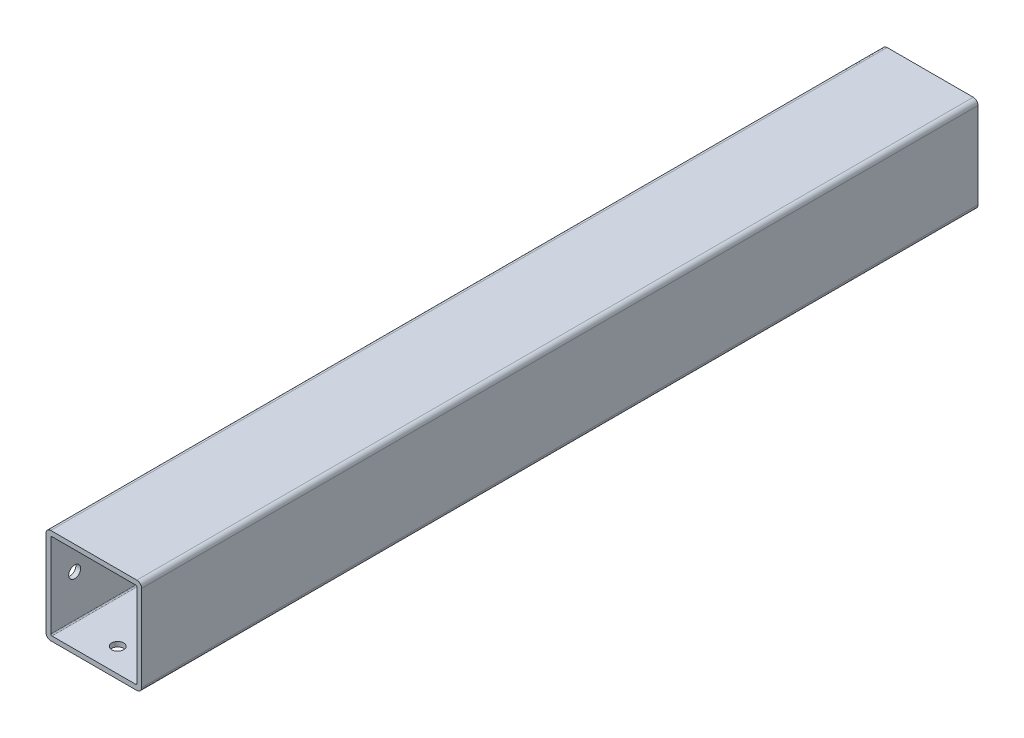
from build123d import *

# Parameters (mm, degrees)
SKETCH1_W           = 40
SKETCH1_H           = 40
SKETCH1_W_2         = 36
SKETCH1_H_2         = 36
EXTRUDE_THIN1_DEPTH = 350
FILLET1_R           = 0.5
FILLET2_R           = 2
SKETCH2_R           = 2.5
CUT_EXTRUDE1_DEPTH  = 352.140997322
CIRPATTERN1_COUNT   = 2
CIRPATTERN1_ANGLE   = 90


with BuildPart() as part:
    # Sketch1 → Extrude-Thin1 (new body)
    with BuildSketch(Plane.XY):
        Rectangle(SKETCH1_W, SKETCH1_H)
        Rectangle(SKETCH1_W_2, SKETCH1_H_2, mode=Mode.SUBTRACT)
    extrude(amount=EXTRUDE_THIN1_DEPTH)

    # Fillet1
    fillet1_edges = [part.edges().sort_by_distance(p)[0] for p in [
        (18, -18, 175),
        (18, 18, 175),
        (-18, 18, 175),
        (-18, -18, 175),
    ]]
    fillet(fillet1_edges, radius=FILLET1_R)

    # Fillet2
    fillet2_edges = [part.edges().sort_by_distance(p)[0] for p in [
        (20, -20, 175),
        (-20, -20, 175),
        (-20, 20, 175),
        (20, 20, 175),
    ]]
    fillet(fillet2_edges, radius=FILLET2_R)

    # Sketch2 → Cut-Extrude1 (cut, through all)
    with BuildSketch(Plane(origin=(0, 0, 0), x_dir=(0, 0, -1), z_dir=(1, 0, 0))):
        with Locations((-340, 0)):
            Circle(SKETCH2_R)
        with Locations((-315, 0)):
            Circle(SKETCH2_R)
    cut_extrude1 = extrude(amount=-CUT_EXTRUDE1_DEPTH, mode=Mode.SUBTRACT)

    # CirPattern1: Cut-Extrude1 ×2 about axis
    cirpattern1_axis = Axis((0, 0, 367.5), (0, 0, 1))
    for i in range(1, CIRPATTERN1_COUNT):
        add(cut_extrude1.rotate(cirpattern1_axis, i * CIRPATTERN1_ANGLE / (CIRPATTERN1_COUNT - 1)), mode=Mode.SUBTRACT)


solid = part.part
